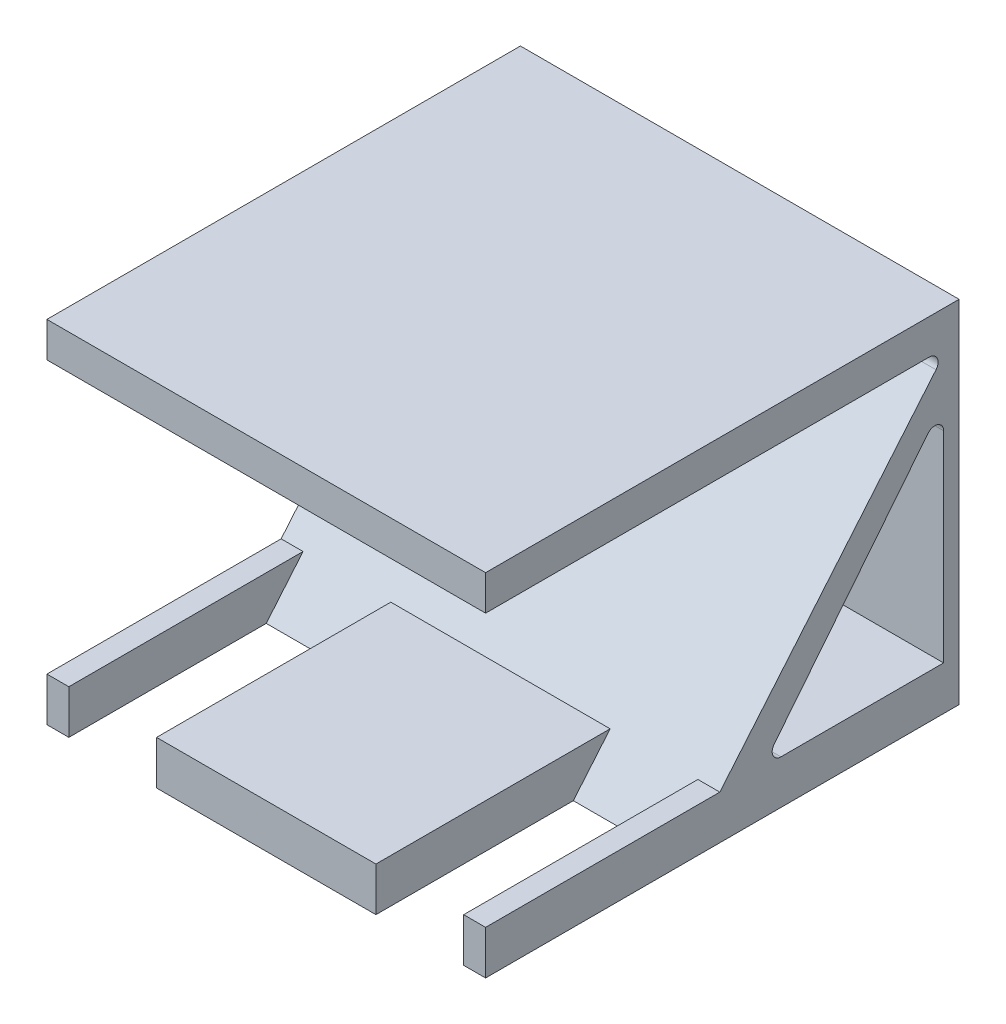
from build123d import *

# Parameters (mm, degrees)
SKETCH_2_W               = 5
SKETCH_2_H               = 90
EXTRUDE_1_DEPTH          = 10
EXTRUDE_1_2_DEPTH        = 10
SKETCH_2_W_2             = 50
EXTRUDE_1_3_DEPTH        = 10
EXTRUDE_5_DEPTH          = 50
SKETCH_5_W               = 107.932472338
SKETCH_5_H               = 8
EXTRUDE_6_DEPTH          = 50
CUT_EXTRUDE_1_DEPTH      = 114.416886857
CUT_EXTRUDE_1_DEPTH_BACK = 114.416886857
FILLET_1_R               = 2
FILLET_2_R               = 2


with BuildPart() as part:
    # 草图2 → 凸台-拉伸1 (new body)
    with BuildSketch(Plane(origin=(0, 0, 0), x_dir=(1, 0, 0), z_dir=(0, 1, 0))):
        with Locations((-47.5, 0)):
            Rectangle(SKETCH_2_W, SKETCH_2_H)
    extrude(amount=EXTRUDE_1_DEPTH)



with BuildPart() as body_2:
    # 草图2 → Extrude 1 2 (new body)
    with BuildSketch(Plane(origin=(0, 0, 0), x_dir=(1, 0, 0), z_dir=(0, 1, 0))):
        with Locations((47.5, 0)):
            Rectangle(SKETCH_2_W, SKETCH_2_H)
    extrude(amount=EXTRUDE_1_2_DEPTH)


with BuildPart() as body_3:
    # 草图2 → Extrude 1 3 (new body)
    with BuildSketch(Plane(origin=(0, 0, 0), x_dir=(1, 0, 0), z_dir=(0, 1, 0))):
        Rectangle(SKETCH_2_W_2, SKETCH_2_H)
    extrude(amount=EXTRUDE_1_3_DEPTH)


with BuildPart() as part_1:
    add(part.part)

    add(body_2.part)  # 凸台-拉伸5 merges body 2

    add(body_3.part)  # 凸台-拉伸5 merges body 3
    # 草图3 → 凸台-拉伸5 (add, symmetric)
    with BuildSketch(Plane(origin=(0, 0, 0), x_dir=(0, 0, -1), z_dir=(1, 0, 0))):
        Polygon((62.932472338, 75), (0, 0), (45, 0), (62.932472338, 0), align=None)
    extrude(amount=EXTRUDE_5_DEPTH, both=True)

    # 草图5 → 凸台-拉伸6 (add, symmetric)
    with BuildSketch(Plane(origin=(0, 0, 0), x_dir=(0, 0, -1), z_dir=(1, 0, 0))):
        with Locations((8.966236169, 76.018086392)):
            Rectangle(SKETCH_5_W, SKETCH_5_H)
    extrude(amount=EXTRUDE_6_DEPTH, both=True)

    # 草图6 → 切除-拉伸1 (cut, two sides: drawn at the far end of the back side and taken through both)
    with BuildSketch(Plane(origin=(0, 0, 0), x_dir=(0, 0, -1), z_dir=(1, 0, 0)).offset(-CUT_EXTRUDE_1_DEPTH_BACK)):
        Polygon((18.156116312, 10), (59.398505248, 61.526811336), (59.398505248, 10), align=None)
    extrude(amount=CUT_EXTRUDE_1_DEPTH + CUT_EXTRUDE_1_DEPTH_BACK, mode=Mode.SUBTRACT)

    # 圆角1
    fillet_1_edges = [part_1.edges().sort_by_distance(p)[0] for p in [
        (0, 61.526811336, -59.398505248),
        (0, 10, -18.156116312),
    ]]
    fillet(fillet_1_edges, radius=FILLET_1_R)

    # 圆角2
    fillet_2_edges = [part_1.edges().sort_by_distance(p)[0] for p in [
        (0, 72.018086392, -60.430349729),
    ]]
    fillet(fillet_2_edges, radius=FILLET_2_R)


solid = part_1.part
